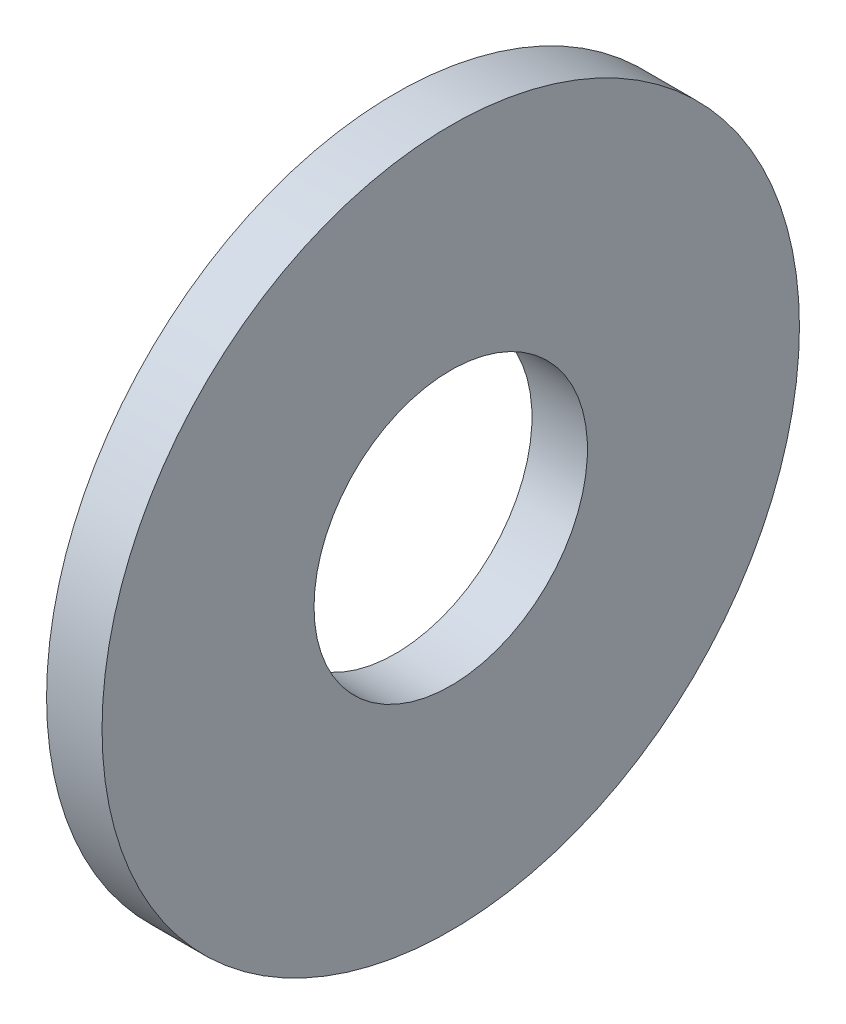
from build123d import *

# Parameters (mm, degrees)
SKETCH1_W = 3.5
SKETCH1_H = 13.375


with BuildPart() as part:
    # Sketch1 → Base-Revolve (revolve)
    with BuildSketch(Plane.XY, mode=Mode.PRIVATE) as base_revolve_sk:
        with Locations((-1.75, 15.3125)):
            Rectangle(SKETCH1_W, SKETCH1_H)
    revolve(base_revolve_sk.sketch.rotate(Axis((-34.925, 0, 0), (1, 0, 0)), 90), axis=Axis((-34.925, 0, 0), (1, 0, 0)))


solid = part.part
